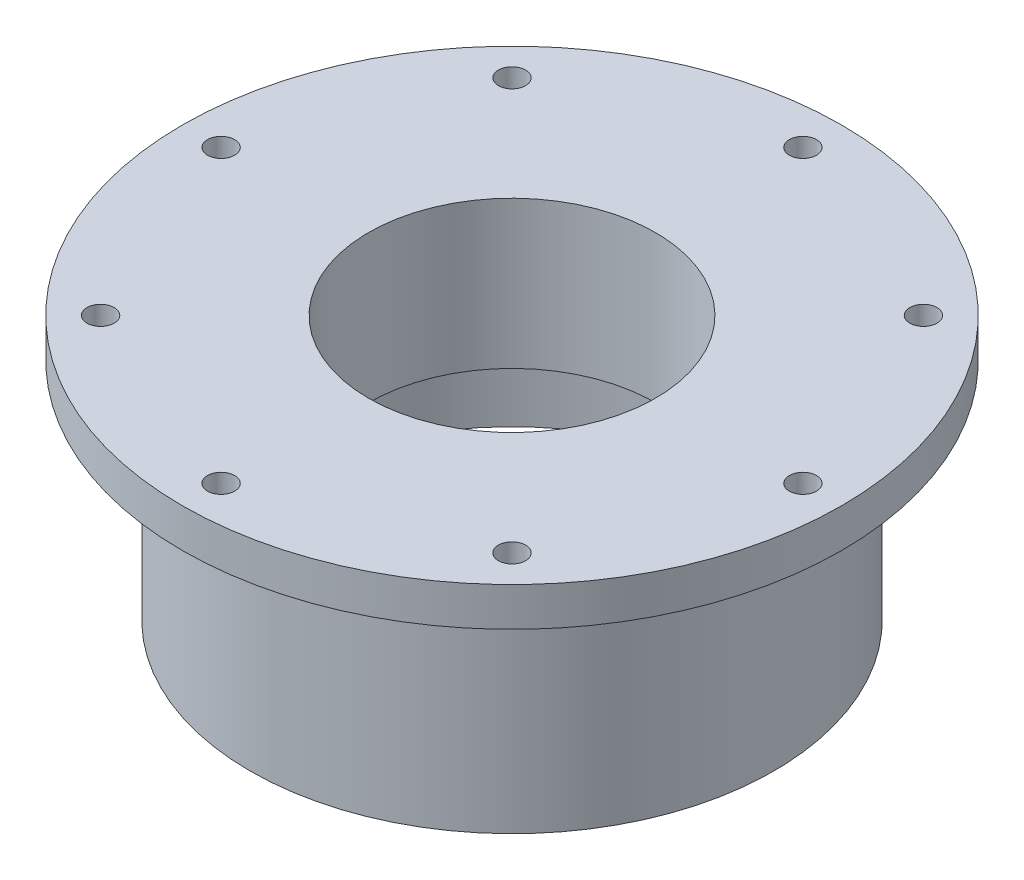
from build123d import *

# Parameters (mm, degrees)
SKETCH1_R           = 42.5
SKETCH1_R_2         = 18.5
SKETCH1_R_3         = 1.75
BOSS_EXTRUDE1_DEPTH = 2.5
BOSS_EXTRUDE2_START = -14
SKETCH2_R           = 33.75
SKETCH2_R_2         = 18.5
BOSS_EXTRUDE2_DEPTH = 14
BOSS_EXTRUDE3_START = 15
SKETCH3_R           = 33.75
SKETCH3_R_2         = 30.5
BOSS_EXTRUDE3_DEPTH = 15


with BuildPart() as part:
    # Sketch1 → Boss-Extrude1 (new, symmetric)
    with BuildSketch(Plane(origin=(0, 0, 0), x_dir=(1, 0, 0), z_dir=(0, 1, 0))):
        with Locations(Location((0, 0, 0), (0, 0, 270))):
            Circle(SKETCH1_R)
        with Locations(Location((0, 0, 0), (0, 0, 270))):
            Circle(SKETCH1_R_2, mode=Mode.SUBTRACT)
        with Locations(Location((0, 37.5, 0), (0, 0, 270))):
            Circle(SKETCH1_R_3, mode=Mode.SUBTRACT)
        with Locations(Location((26.516504294, 26.516504294, 0), (0, 0, 270))):
            Circle(SKETCH1_R_3, mode=Mode.SUBTRACT)
        with Locations(Location((37.5, 0, 0), (0, 0, 270))):
            Circle(SKETCH1_R_3, mode=Mode.SUBTRACT)
        with Locations(Location((26.516504294, -26.516504294, 0), (0, 0, 270))):
            Circle(SKETCH1_R_3, mode=Mode.SUBTRACT)
        with Locations(Location((0, -37.5, 0), (0, 0, 270))):
            Circle(SKETCH1_R_3, mode=Mode.SUBTRACT)
        with Locations(Location((-26.516504294, -26.516504294, 0), (0, 0, 270))):
            Circle(SKETCH1_R_3, mode=Mode.SUBTRACT)
        with Locations(Location((-37.5, 0, 0), (0, 0, 270))):
            Circle(SKETCH1_R_3, mode=Mode.SUBTRACT)
        with Locations(Location((-26.516504294, 26.516504294, 0), (0, 0, 270))):
            Circle(SKETCH1_R_3, mode=Mode.SUBTRACT)
    extrude(amount=BOSS_EXTRUDE1_DEPTH, both=True)

    # Sketch2 → Boss-Extrude2 (add)
    with BuildSketch(Plane(origin=(0, -2.5, 0), x_dir=(1, 0, 0), z_dir=(0, 1, 0)).offset(BOSS_EXTRUDE2_START)):
        with Locations(Location((0, 0, 0), (0, 0, 270))):
            Circle(SKETCH2_R)
        with Locations(Location((0, 0, 0), (0, 0, 270))):
            Circle(SKETCH2_R_2, mode=Mode.SUBTRACT)
    extrude(amount=BOSS_EXTRUDE2_DEPTH)

    # Sketch3 → Boss-Extrude3 (add)
    with BuildSketch(Plane.XZ.offset(16.5).offset(BOSS_EXTRUDE3_START)):
        with Locations(Location((0, 0, 0), (0, 0, 90))):
            Circle(SKETCH3_R)
        with Locations(Location((0, 0, 0), (0, 0, 270))):
            Circle(SKETCH3_R_2, mode=Mode.SUBTRACT)
    extrude(amount=-BOSS_EXTRUDE3_DEPTH)


solid = part.part
